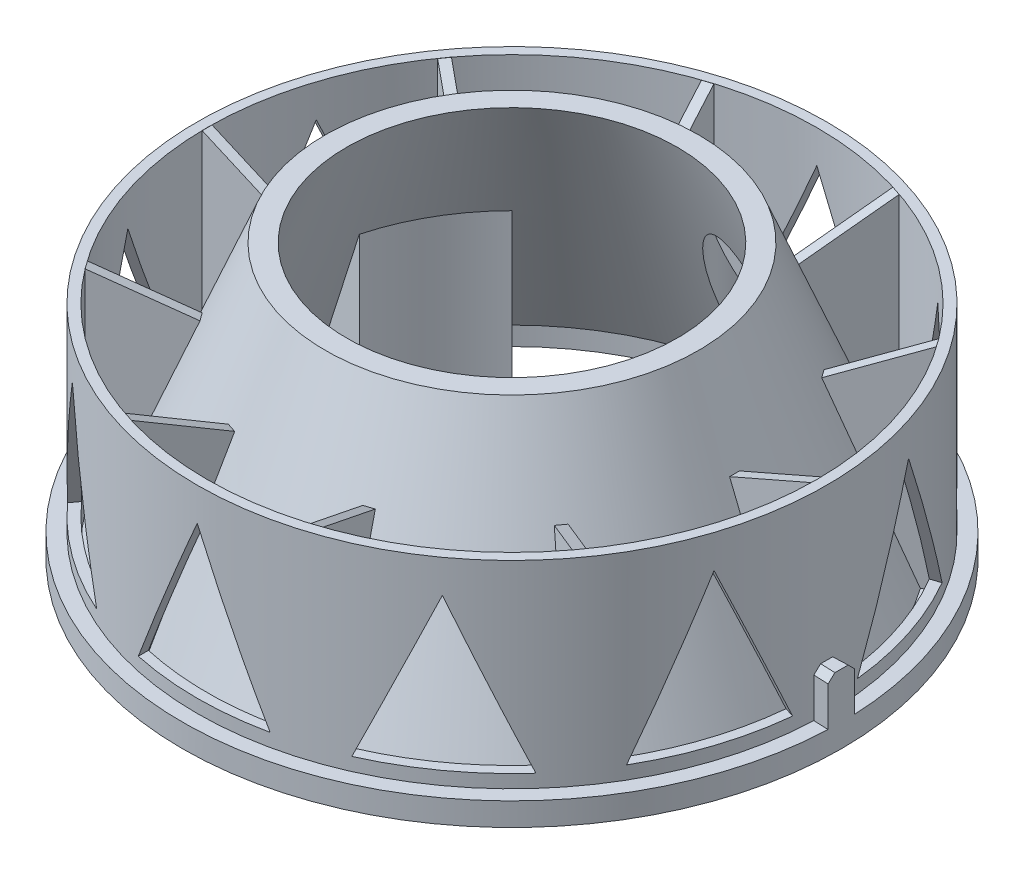
from build123d import *

# Parameters (mm, degrees)
EXTRUDE_750_DEPTH                    = 0.75
PATTERN_CIRCULAR_809_COUNT           = 10
CUT_EXTRUDE_945_DEPTH                = 37.9
CUT_EXTRUDE_945_DEPTH_BACK           = 24.5
SKETCH_3_R                           = 5
CUT_EXTRUDE_1403_DEPTH               = 3
PATTERN_CIRCULAR_2_COUNT             = 6
CUT_EXTRUDE_START                    = 45.15598
CUT_EXTRUDE_1_DEPTH                  = 2.59402
PATTERN_CIRCULAR_3_COUNT             = 10
EXTRUDE_1_DEPTH                      = 7
CHAMFER_1_SIZE                       = 1
SKETCH_8_R                           = 50
SKETCH_8_R_2                         = 45
CUT_EXTRUDE_2_DEPTH                  = 1.5
EXTRUDE_2_REACH                      = 83.24
PATTERN_CIRCULAR_4_COUNT             = 3
SKETCH_10_R                          = 2.2
CUT_EXTRUDE_3_DEPTH                  = 12
CHAMFER_2_SIZE                       = 1
PATTERN_CIRCULAR_5_COUNT             = 3
CHAMFER_2_OF_PATTERN_CIRCULAR_5_SIZE = 1


with BuildPart() as part:
    # Эскиз1 → Повернуть1 (revolve)
    with BuildSketch(Plane.XY, mode=Mode.PRIVATE) as revolve_1_sk:
        Polygon((46.25, 35), (47.75, 35), (47.75, 5), (50, 5), (50, 0), (32.75, 0), (32.75, 3), (41.25, 3), (25.088950967, 43), (28.324555195, 43), (44.485604228, 3), (46.25, 3), align=None)
    revolve(revolve_1_sk.sketch.rotate(Axis((0, 0, 0), (0, 1, 0)), 90), axis=Axis((0, 0, 0), (0, 1, 0)))

    # Эскиз2 → Extrude 750 (add, symmetric)
    with BuildSketch(Plane.XY):
        Polygon((46.326460667, 35), (33.75500323, 29.508377561), (44.425581072, 2.377813311), (46.326460667, 2.377813311), align=None)
    extrude_750 = extrude(amount=EXTRUDE_750_DEPTH, both=True)

    # Pattern Circular 809: Extrude 750 ×10 about axis
    pattern_circular_809_axis = Axis((0, 0, 0), (0, 1, 0))
    for i in range(1, PATTERN_CIRCULAR_809_COUNT):
        add(extrude_750.rotate(pattern_circular_809_axis, i * 360 / PATTERN_CIRCULAR_809_COUNT))

    # Эскиз3 → Cut-Extrude 945 (cut, two sides: drawn at the far end of the back side and taken through both)
    with BuildSketch(Plane(origin=(0, 0, 0), x_dir=(1, 0, 0), z_dir=(0, 1, 0)).offset(-CUT_EXTRUDE_945_DEPTH_BACK)):
        with Locations(Location((0, 36, 0), (0, 0, 90.000000022))):
            Circle(SKETCH_3_R)
    extrude(amount=CUT_EXTRUDE_945_DEPTH + CUT_EXTRUDE_945_DEPTH_BACK, mode=Mode.SUBTRACT)

    # Эскиз4 → Cut-Extrude 1403 (cut)
    with BuildSketch(Plane(origin=(0, 0, 0), x_dir=(1, 0, 0), z_dir=(0, 1, 0))):
        with BuildLine():
            Line((0, 0), (-29.344931419, 29.344931419))
            ThreePointArc((-29.344931419, 29.344931419), (-20.75, 35.940054257), (-10.740990372, 40.085921791))
            Line((-10.740990372, 40.085921791), (0, 0))
        make_face()
    cut_extrude_1403 = extrude(amount=CUT_EXTRUDE_1403_DEPTH, mode=Mode.SUBTRACT)

    # Круговой массив2: Cut-Extrude 1403 ×6 about axis
    pattern_circular_2_axis = Axis((0, 0, 0), (0, 1, 0))
    for i in range(1, PATTERN_CIRCULAR_2_COUNT):
        add(cut_extrude_1403.rotate(pattern_circular_2_axis, i * 360 / PATTERN_CIRCULAR_2_COUNT), mode=Mode.SUBTRACT)

    # Эскиз5 → Вырез-Вытянуть1 (cut)
    with BuildSketch(Plane.XY.offset(CUT_EXTRUDE_START)):
        Polygon((-10, 7), (0, 30), (10, 7), align=None)
    cut_extrude_1 = extrude(amount=CUT_EXTRUDE_1_DEPTH, mode=Mode.SUBTRACT)

    # Круговой массив3: Вырез-Вытянуть1 ×10 about axis
    pattern_circular_3_axis = Axis((0, 0, 0), (0, 1, 0))
    for i in range(1, PATTERN_CIRCULAR_3_COUNT):
        add(cut_extrude_1.rotate(pattern_circular_3_axis, i * 360 / PATTERN_CIRCULAR_3_COUNT), mode=Mode.SUBTRACT)

    # Эскиз7 → Бобышка-Вытянуть1 (add)
    with BuildSketch(Plane(origin=(0, 5, 0), x_dir=(1, 0, 0), z_dir=(0, 1, 0))):
        with BuildLine():
            ThreePointArc((47.711784708, 1.91), (47.740445221, 0.955191134), (47.75, 0))
            Line((47.75, 0), (50, 0))
            ThreePointArc((50, 0), (49.989994996, 1.00020014), (49.959983987, 2))
            Line((49.959983987, 2), (47.711784708, 1.91))
        make_face()
        with BuildLine():
            Line((50, 0), (47.75, 0))
            ThreePointArc((47.75, 0), (47.740445221, -0.955191134), (47.711784708, -1.91))
            Line((47.711784708, -1.91), (49.959983987, -2))
            ThreePointArc((49.959983987, -2), (49.989994996, -1.00020014), (50, 0))
        make_face()
    extrude(amount=EXTRUDE_1_DEPTH)

    # Фаска1
    chamfer_1_edges = [part.edges().sort_by_distance(p)[0] for p in [
        (48.835884347, 12, -1.955),
        (48.835884347, 12, 1.955),
    ]]
    chamfer(chamfer_1_edges, length=CHAMFER_1_SIZE)

    # Эскиз8 → Вырез-Вытянуть2 (cut)
    with BuildSketch(Plane.XZ):
        with Locations(Location((0, 0, 0), (0, 0, 270))):
            Circle(SKETCH_8_R)
        with Locations(Location((0, 0, 0), (0, 0, 270))):
            Circle(SKETCH_8_R_2, mode=Mode.SUBTRACT)
    extrude(amount=-CUT_EXTRUDE_2_DEPTH, mode=Mode.SUBTRACT)

    # Эскиз9 → Бобышка-Вытянуть2 (add, up to next)
    with BuildSketch(Plane(origin=(0, 3, 0), x_dir=(1, 0, 0), z_dir=(0, 1, 0)), mode=Mode.PRIVATE) as extrude_2_sk1:
        with BuildLine():
            Line((31.634070811, 8.476323727), (39.844440334, 10.67628561))
            ThreePointArc((39.844440334, 10.67628561), (35.723547906, 20.625), (29.168154724, 29.168154724))
            Line((29.168154724, 29.168154724), (23.157747084, 23.157747084))
            ThreePointArc((23.157747084, 23.157747084), (28.362331974, 16.375), (31.634070811, 8.476323727))
        make_face()
    extrude_2_tool1 = extrude(extrude_2_sk1.sketch, amount=EXTRUDE_2_REACH, mode=Mode.PRIVATE) - part.part
    extrude_2 = extrude_2_tool1.solids().sort_by_distance((31.817481, 3, -18.369831))[0]
    add(extrude_2)

    # Круговой массив4: Бобышка-Вытянуть2 ×3 about axis
    pattern_circular_4_axis = Axis((0, 0, 0), (0, -1, 0))
    for i in range(1, PATTERN_CIRCULAR_4_COUNT):
        add(extrude_2.rotate(pattern_circular_4_axis, i * 360 / PATTERN_CIRCULAR_4_COUNT))

    # Эскиз10 → Вырез-Вытянуть3 (cut)
    with BuildSketch(Plane.XZ):
        with Locations(Location((0, 37.5, 0), (0, 0, 270))):
            Circle(SKETCH_10_R)
    cut_extrude_3 = extrude(amount=-CUT_EXTRUDE_3_DEPTH, mode=Mode.SUBTRACT)

    # Фаска2
    chamfer_2_edges = [part.edges().sort_by_distance(p)[0] for p in [
        (0, 0, 39.7),
    ]]
    chamfer(chamfer_2_edges, length=CHAMFER_2_SIZE)

    # Круговой массив5: Вырез-Вытянуть3 ×3 about axis
    pattern_circular_5_axis = Axis((0, 0, 0), (0, 1, 0))
    for i in range(1, PATTERN_CIRCULAR_5_COUNT):
        add(cut_extrude_3.rotate(pattern_circular_5_axis, i * 360 / PATTERN_CIRCULAR_5_COUNT), mode=Mode.SUBTRACT)

    # Фаска2 of Круговой массив5
    chamfer_2_of_pattern_circular_5_edges = [part.edges().sort_by_distance(p)[0] for p in [
        (34.38120853, 0, -19.85),
        (-34.38120853, 0, -19.85),
    ]]
    chamfer(chamfer_2_of_pattern_circular_5_edges, length=CHAMFER_2_OF_PATTERN_CIRCULAR_5_SIZE)


solid = part.part
